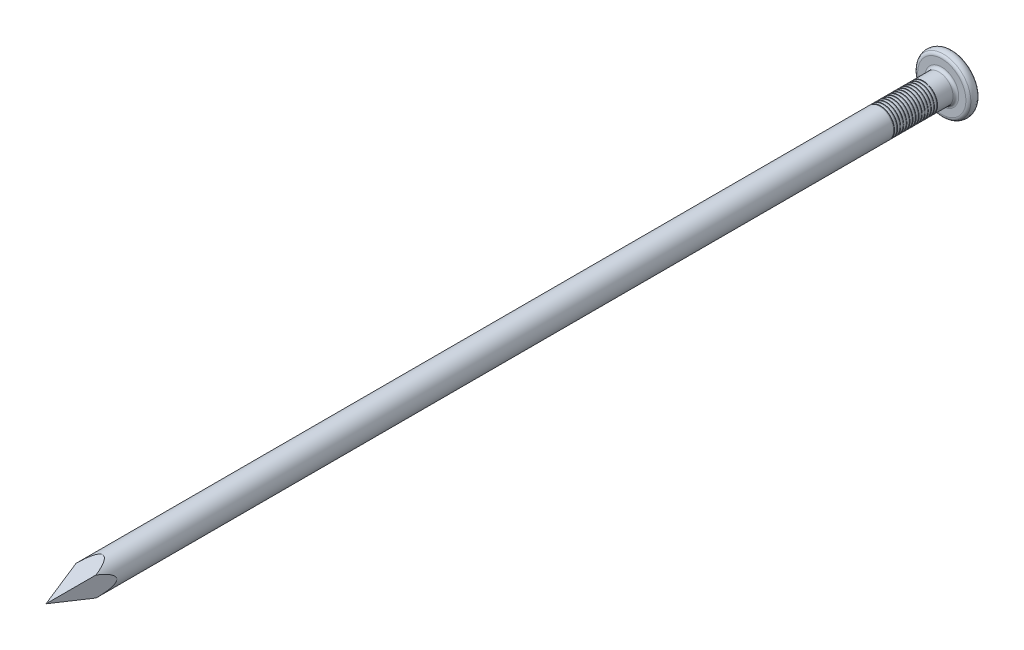
from build123d import *

# Parameters (mm, degrees)
CUT_EXTRUDE1_DEPTH  = 153.548755526
CIRPATTERN1_COUNT   = 4
SKETCH6_W           = 0.3175
SKETCH6_H           = 19.05
CUT_EXTRUDE3_DEPTH  = 154.364331947
BOSS_EXTRUDE1_START = 6.19125
SKETCH7_R           = 4.6355
BOSS_EXTRUDE1_DEPTH = 14.76375
FILLET1_R           = 0.9525


with BuildPart() as part:
    # Sketch2 → Revolve1 (revolve)
    with BuildSketch(Plane(origin=(0, 0, 0), x_dir=(0, 0, -1), z_dir=(1, 0, 0)), mode=Mode.PRIVATE) as revolve1_sk:
        Polygon((-133.35, -4.7625), (152.4, -4.7625), (152.4, 0), (-152.4, 0), (-152.4, -4.7625), align=None)
    revolve(revolve1_sk.sketch.rotate(Axis((0, 0, 152.4), (0, 0, -1)), 270), axis=Axis((0, 0, 152.4), (0, 0, -1)))

    # Sketch3 → Cut-Extrude1 (cut, symmetric)
    with BuildSketch(Plane(origin=(0, 0, 0), x_dir=(0, 0, -1), z_dir=(1, 0, 0))):
        Polygon((-152.4, -0.00254), (-133.35, -4.7625), (-152.4, -4.7625), align=None)
    cut_extrude1 = extrude(amount=CUT_EXTRUDE1_DEPTH, both=True, mode=Mode.SUBTRACT)

    # CirPattern1: Cut-Extrude1 ×4 about axis
    cirpattern1_axis = Axis((0, 0, 0), (0, 0, 1))
    for i in range(1, CIRPATTERN1_COUNT):
        add(cut_extrude1.rotate(cirpattern1_axis, i * 360 / CIRPATTERN1_COUNT), mode=Mode.SUBTRACT)

    # Sketch5 → Revolve2 (revolve)
    with BuildSketch(Plane(origin=(0, 0, 0), x_dir=(0, 0, -1), z_dir=(1, 0, 0)), mode=Mode.PRIVATE) as revolve2_sk:
        with BuildLine():
            Line((148.828125, 0), (152.4, 0))
            Line((152.4, 0), (152.4, 8.105021576))
            ThreePointArc((152.4, 8.105021576), (152.243002117, 8.716680214), (151.810824742, 9.177111904))
            ThreePointArc((151.810824742, 9.177111904), (150.6140625, 9.525), (149.417300258, 9.177111904))
            ThreePointArc((149.417300258, 9.177111904), (148.985122883, 8.716680214), (148.828125, 8.105021576))
            Line((148.828125, 8.105021576), (148.828125, 0))
        make_face()
    revolve(revolve2_sk.sketch.rotate(Axis((0, 0, -152.4), (0, 0, 1)), 90), axis=Axis((0, 0, -152.4), (0, 0, 1)))

    # Sketch6 → Cut-Extrude3 (cut, through all)
    with BuildSketch(Plane(origin=(4.7625, 0, 0), x_dir=(0, 0, -1), z_dir=(1, 0, 0))):
        with Locations((140.414375, 0)):
            Rectangle(SKETCH6_W, SKETCH6_H)
        with Locations((142.478125, 0)):
            Rectangle(SKETCH6_W, SKETCH6_H)
        with Locations((141.44625, 0)):
            Rectangle(SKETCH6_W, SKETCH6_H)
        with Locations((139.3825, 0)):
            Rectangle(SKETCH6_W, SKETCH6_H)
        with Locations((138.350625, 0)):
            Rectangle(SKETCH6_W, SKETCH6_H)
        with Locations((137.31875, 0)):
            Rectangle(SKETCH6_W, SKETCH6_H)
        with Locations((136.286875, 0)):
            Rectangle(SKETCH6_W, SKETCH6_H)
        with Locations((135.255, 0)):
            Rectangle(SKETCH6_W, SKETCH6_H)
        with Locations((134.223125, 0)):
            Rectangle(SKETCH6_W, SKETCH6_H)
        with Locations((133.19125, 0)):
            Rectangle(SKETCH6_W, SKETCH6_H)
        with Locations((132.159375, 0)):
            Rectangle(SKETCH6_W, SKETCH6_H)
        with Locations((131.1275, 0)):
            Rectangle(SKETCH6_W, SKETCH6_H)
        with Locations((130.095625, 0)):
            Rectangle(SKETCH6_W, SKETCH6_H)
        with Locations((129.06375, 0)):
            Rectangle(SKETCH6_W, SKETCH6_H)
        with Locations((128.031875, 0)):
            Rectangle(SKETCH6_W, SKETCH6_H)
    extrude(amount=-CUT_EXTRUDE3_DEPTH, mode=Mode.SUBTRACT)


with BuildPart() as cut_extrude3_piece_1:
    # of the separate pieces the step leaves, piece 1, a body of its own (cut_extrude3_pieces)
    add(part.part.solids().sort_by_distance((4.7625, 0, -127.873125))[0])



with BuildPart() as cut_extrude3_piece_2:
    # of the separate pieces the step leaves, piece 2, a body of its own (cut_extrude3_pieces)
    add(part.part.solids().sort_by_distance((-8.105021576, 0, -152.4))[0])


with BuildPart() as cut_extrude3_piece_3:
    # of the separate pieces the step leaves, piece 3, a body of its own (cut_extrude3_pieces)
    add(part.part.solids().sort_by_distance((4.7625, 0, -142.319375))[0])


with BuildPart() as cut_extrude3_piece_4:
    # of the separate pieces the step leaves, piece 4, a body of its own (cut_extrude3_pieces)
    add(part.part.solids().sort_by_distance((4.7625, 0, -141.2875))[0])


with BuildPart() as cut_extrude3_piece_5:
    # of the separate pieces the step leaves, piece 5, a body of its own (cut_extrude3_pieces)
    add(part.part.solids().sort_by_distance((4.7625, 0, -138.191875))[0])


with BuildPart() as cut_extrude3_piece_6:
    # of the separate pieces the step leaves, piece 6, a body of its own (cut_extrude3_pieces)
    add(part.part.solids().sort_by_distance((4.7625, 0, -137.16))[0])


with BuildPart() as cut_extrude3_piece_7:
    # of the separate pieces the step leaves, piece 7, a body of its own (cut_extrude3_pieces)
    add(part.part.solids().sort_by_distance((4.7625, 0, -136.128125))[0])


with BuildPart() as cut_extrude3_piece_8:
    # of the separate pieces the step leaves, piece 8, a body of its own (cut_extrude3_pieces)
    add(part.part.solids().sort_by_distance((4.7625, 0, -134.064375))[0])


with BuildPart() as cut_extrude3_piece_9:
    # of the separate pieces the step leaves, piece 9, a body of its own (cut_extrude3_pieces)
    add(part.part.solids().sort_by_distance((4.7625, 0, -133.0325))[0])


with BuildPart() as cut_extrude3_piece_10:
    # of the separate pieces the step leaves, piece 10, a body of its own (cut_extrude3_pieces)
    add(part.part.solids().sort_by_distance((4.7625, 0, -132.000625))[0])


with BuildPart() as cut_extrude3_piece_11:
    # of the separate pieces the step leaves, piece 11, a body of its own (cut_extrude3_pieces)
    add(part.part.solids().sort_by_distance((4.7625, 0, -130.96875))[0])


with BuildPart() as cut_extrude3_piece_12:
    # of the separate pieces the step leaves, piece 12, a body of its own (cut_extrude3_pieces)
    add(part.part.solids().sort_by_distance((4.7625, 0, -129.936875))[0])


with BuildPart() as cut_extrude3_piece_13:
    # of the separate pieces the step leaves, piece 13, a body of its own (cut_extrude3_pieces)
    add(part.part.solids().sort_by_distance((4.7625, 0, -128.905))[0])


with BuildPart() as cut_extrude3_piece_14:
    # of the separate pieces the step leaves, piece 14, a body of its own (cut_extrude3_pieces)
    add(part.part.solids().sort_by_distance((4.7625, 0, -140.255625))[0])


with BuildPart() as cut_extrude3_piece_15:
    # of the separate pieces the step leaves, piece 15, a body of its own (cut_extrude3_pieces)
    add(part.part.solids().sort_by_distance((4.7625, 0, -139.22375))[0])


with BuildPart() as cut_extrude3_piece_16:
    # of the separate pieces the step leaves, piece 16, a body of its own (cut_extrude3_pieces)
    add(part.part.solids().sort_by_distance((4.7625, 0, -135.09625))[0])


with BuildPart() as cut_extrude3_piece_1_1:
    add(cut_extrude3_piece_1.part)

    add(cut_extrude3_piece_2.part)  # Boss-Extrude1 merges Cut-Extrude3 piece 2

    add(cut_extrude3_piece_3.part)  # Boss-Extrude1 merges Cut-Extrude3 piece 3

    add(cut_extrude3_piece_4.part)  # Boss-Extrude1 merges Cut-Extrude3 piece 4

    add(cut_extrude3_piece_5.part)  # Boss-Extrude1 merges Cut-Extrude3 piece 5

    add(cut_extrude3_piece_6.part)  # Boss-Extrude1 merges Cut-Extrude3 piece 6

    add(cut_extrude3_piece_7.part)  # Boss-Extrude1 merges Cut-Extrude3 piece 7

    add(cut_extrude3_piece_8.part)  # Boss-Extrude1 merges Cut-Extrude3 piece 8

    add(cut_extrude3_piece_9.part)  # Boss-Extrude1 merges Cut-Extrude3 piece 9

    add(cut_extrude3_piece_10.part)  # Boss-Extrude1 merges Cut-Extrude3 piece 10

    add(cut_extrude3_piece_11.part)  # Boss-Extrude1 merges Cut-Extrude3 piece 11

    add(cut_extrude3_piece_12.part)  # Boss-Extrude1 merges Cut-Extrude3 piece 12

    add(cut_extrude3_piece_13.part)  # Boss-Extrude1 merges Cut-Extrude3 piece 13

    add(cut_extrude3_piece_14.part)  # Boss-Extrude1 merges Cut-Extrude3 piece 14

    add(cut_extrude3_piece_15.part)  # Boss-Extrude1 merges Cut-Extrude3 piece 15

    add(cut_extrude3_piece_16.part)  # Boss-Extrude1 merges Cut-Extrude3 piece 16
    # Sketch7 → Boss-Extrude1 (add)
    with BuildSketch(Plane.XY.offset(-148.828125).offset(BOSS_EXTRUDE1_START)):
        with Locations(Location((0, 0, 0), (0, 0, 180))):
            Circle(SKETCH7_R)
    extrude(amount=BOSS_EXTRUDE1_DEPTH)

    # Fillet1
    fillet1_edges = [cut_extrude3_piece_1_1.edges().sort_by_distance(p)[0] for p in [
        (-4.7625, 0, -148.828125),
    ]]
    fillet(fillet1_edges, radius=FILLET1_R)


solid = cut_extrude3_piece_1_1.part
